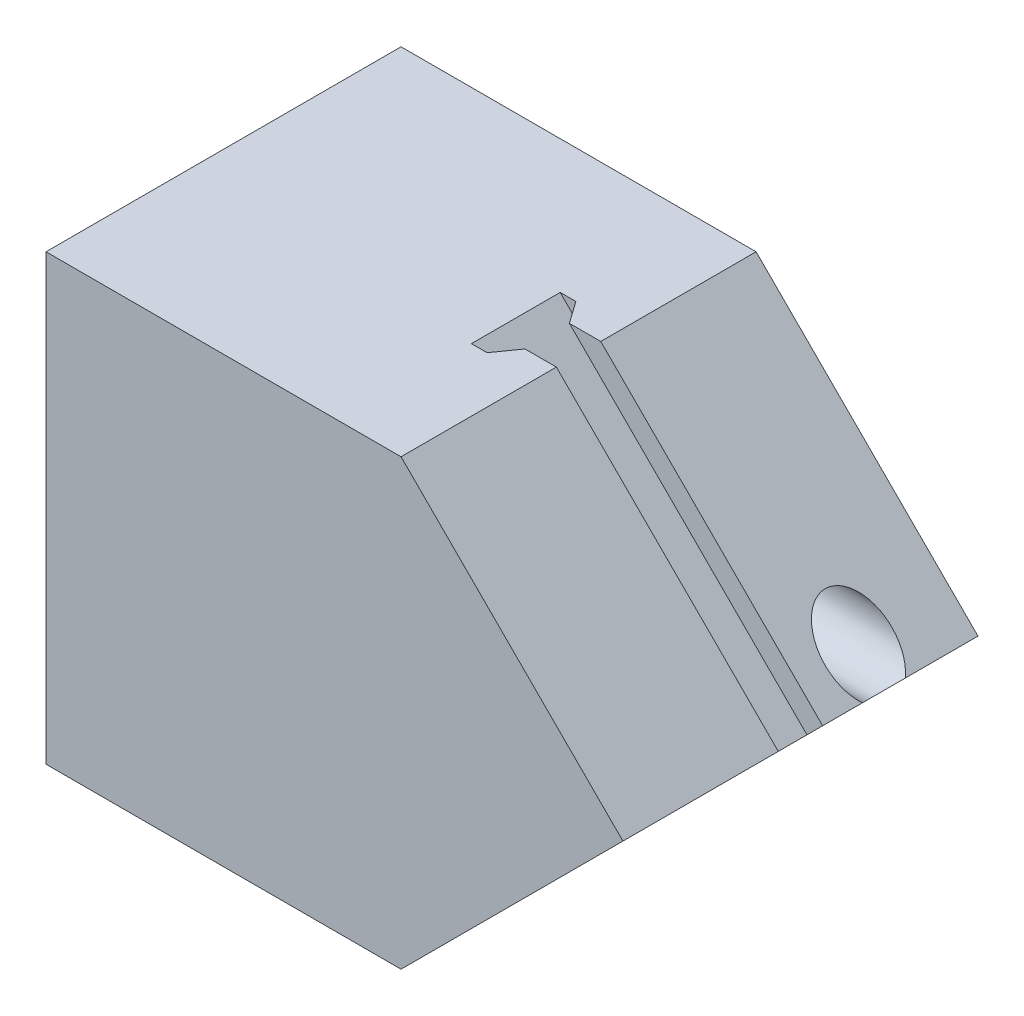
from build123d import *

# Parameters (mm, degrees)
EXTRUDE_1_DEPTH          = 40
SKETCH_2_R               = 7.5
CUT_EXTRUDE_1_DEPTH      = 154.948043183
CUT_EXTRUDE_2_DEPTH      = 141.356688476
CUT_EXTRUDE_2_DEPTH_BACK = 141.356688476
CUT_EXTRUDE_3_DEPTH      = 169.819430161
CUT_EXTRUDE_3_DEPTH_BACK = 169.819430161
SKETCH_4_W               = 39.056064152
SKETCH_4_H               = 128.107121435


with BuildPart() as part:
    # 草图1 → 凸台-拉伸1 (new, symmetric)
    with BuildSketch(Plane.XY):
        Polygon((-140, 50), (-140, -50), (-50, -50), (0, 0), (-50, 50), align=None)
    extrude(amount=EXTRUDE_1_DEPTH, both=True)

    # 草图2 → 切除-拉伸1 (cut, through all)
    with BuildSketch(Plane.ZY.offset(140)):
        with Locations((-18.807269804, 5.733234466)):
            Circle(SKETCH_2_R)
    extrude(amount=-CUT_EXTRUDE_1_DEPTH, mode=Mode.SUBTRACT)

    # 草图3 → 切除-拉伸2 (cut, two sides: drawn at the far end of the back side and taken through both)
    with BuildSketch(Plane(origin=(-50, 50, 0), x_dir=(0, 0, -1), z_dir=(0.7071067811865509, -0.7071067811865441, 0)).offset(-CUT_EXTRUDE_2_DEPTH_BACK)):
        Polygon((5, 5), (-5, 5), (-5, -5), (-10, -7.5), (-10, -10), (10, -10), (10, -7.5), (5, -5), align=None)
    extrude(amount=CUT_EXTRUDE_2_DEPTH + CUT_EXTRUDE_2_DEPTH_BACK, mode=Mode.SUBTRACT)

    # 草图4 → 切除-拉伸3 (cut, two sides: drawn at the far end of the back side and taken through both)
    with BuildSketch(Plane.XY.offset(40).offset(-CUT_EXTRUDE_3_DEPTH_BACK)):
        with Locations((-149.528032076, -5.637932913)):
            Rectangle(SKETCH_4_W, SKETCH_4_H)
    extrude(amount=CUT_EXTRUDE_3_DEPTH + CUT_EXTRUDE_3_DEPTH_BACK, mode=Mode.SUBTRACT)


solid = part.part
